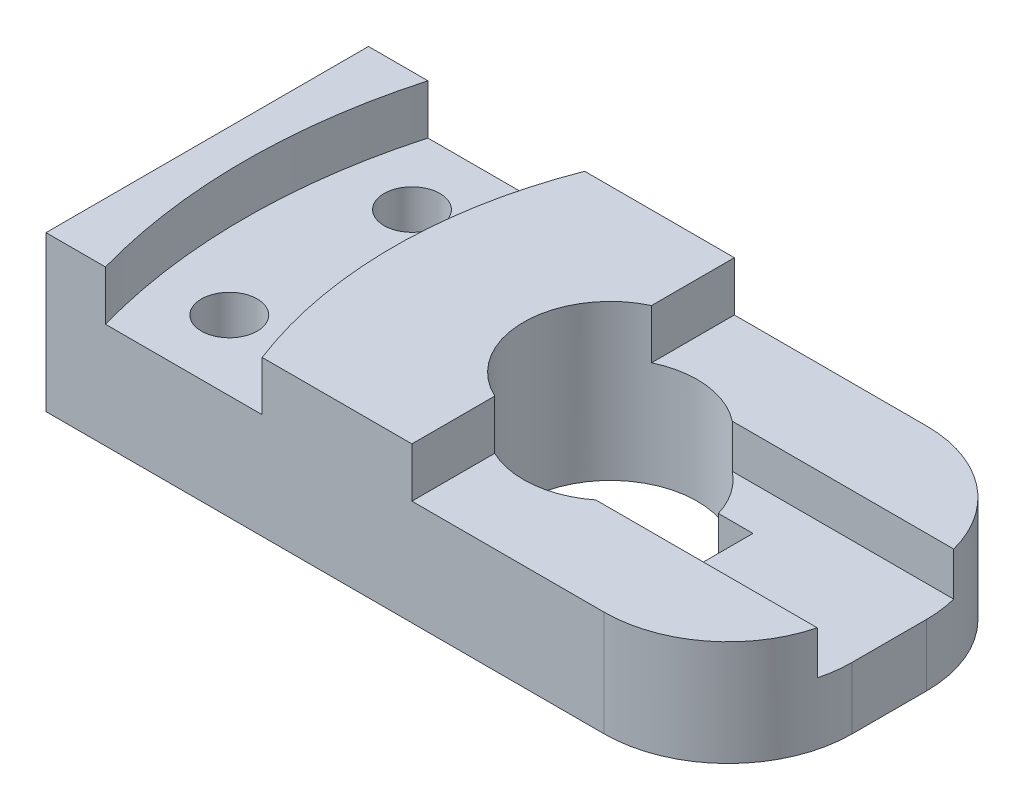
from build123d import *

# Parameters (mm, degrees)
BOSS_EXTRUDE1_DEPTH = 25
SKETCH1_3_R         = 4.5
BOSS_EXTRUDE2_DEPTH = 17
BOSS_EXTRUDE3_DEPTH = 25
BOSS_EXTRUDE4_DEPTH = 10


with BuildPart() as part:
    # Sketch1 → Boss-Extrude1 (new body)
    with BuildSketch(Plane(origin=(0, 0, 0), x_dir=(1, 0, 0), z_dir=(0, 1, 0))):
        with BuildLine():
            Line((0, 26), (0, -26))
            Line((0, -26), (9.587879583, -26))
            ThreePointArc((9.587879583, -26), (6, 0), (9.587879583, 26))
            Line((9.587879583, 26), (0, 26))
        make_face()
    extrude(amount=BOSS_EXTRUDE1_DEPTH)

    # Sketch1<3> → Boss-Extrude2 (add)
    with BuildSketch(Plane(origin=(0, 0, 0), x_dir=(1, 0, 0), z_dir=(0, 1, 0))):
        with BuildLine():
            ThreePointArc((9.587879583, 26), (6, 0), (9.587879583, -26))
            Line((9.587879583, -26), (90, -26))
            ThreePointArc((90, -26), (102.247448714, -21.811388301), (109.364916731, -11))
            Line((109.364916731, -11), (73.660254038, -11))
            ThreePointArc((73.660254038, -11), (51, 0), (73.660254038, 11))
            Line((73.660254038, 11), (109.364916731, 11))
            ThreePointArc((109.364916731, 11), (102.247448714, 21.811388301), (90, 26))
            Line((90, 26), (9.587879583, 26))
        make_face()
        with Locations((18.285849122, -14.728915195)):
            Circle(SKETCH1_3_R, mode=Mode.SUBTRACT)
        with Locations((18.285849122, 14.728915195)):
            Circle(SKETCH1_3_R, mode=Mode.SUBTRACT)
    extrude(amount=BOSS_EXTRUDE2_DEPTH)

    # Sketch1<4> → Boss-Extrude3 (add)
    with BuildSketch(Plane(origin=(0, 0, 0), x_dir=(1, 0, 0), z_dir=(0, 1, 0))):
        with BuildLine():
            ThreePointArc((34.858358674, 26), (30, 0), (34.858358674, -26))
            Line((34.858358674, -26), (59, -26))
            Line((59, -26), (59, -12.649110641))
            ThreePointArc((59, -12.649110641), (51, 0), (59, 12.649110641))
            Line((59, 12.649110641), (59, 26))
            Line((59, 26), (34.858358674, 26))
        make_face()
    extrude(amount=BOSS_EXTRUDE3_DEPTH)

    # Sketch1<5> → Boss-Extrude4 (add)
    with BuildSketch(Plane(origin=(0, 0, 0), x_dir=(1, 0, 0), z_dir=(0, 1, 0))):
        with BuildLine():
            Line((73.660254038, -11), (109.364916731, -11))
            ThreePointArc((109.364916731, -11), (109.840593925, -8.52008585), (110, -6))
            Line((110, -6), (110, 6))
            ThreePointArc((110, 6), (109.840593925, 8.52008585), (109.364916731, 11))
            Line((109.364916731, 11), (73.660254038, 11))
            ThreePointArc((73.660254038, 11), (76.579928765, 7.86798893), (78.416407865, 4))
            Line((78.416407865, 4), (84, 4))
            Line((84, 4), (84, -4))
            Line((84, -4), (78.416407865, -4))
            ThreePointArc((78.416407865, -4), (76.579928765, -7.86798893), (73.660254038, -11))
        make_face()
    extrude(amount=BOSS_EXTRUDE4_DEPTH)


solid = part.part
